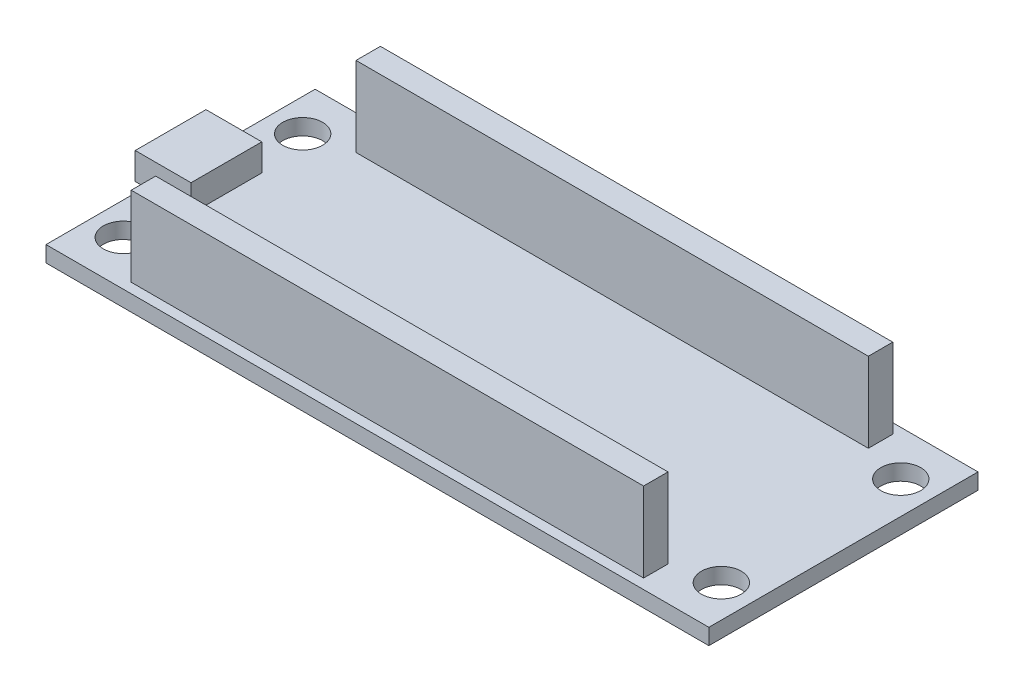
from build123d import *

# Parameters (mm, degrees)
SKETCH1_W           = 66.5
SKETCH1_H           = 27
SKETCH1_R           = 2
BOSS_EXTRUDE1_DEPTH = 1.6
SKETCH2_W           = 5.6
SKETCH2_H           = 7.1
BOSS_EXTRUDE2_DEPTH = 2.7
SKETCH3_W           = 51.4
SKETCH3_H           = 2.45
BOSS_EXTRUDE3_DEPTH = 8


with BuildPart() as part:
    # Sketch1 → Boss-Extrude1 (new body)
    with BuildSketch(Plane(origin=(0, 0, 0), x_dir=(1, 0, 0), z_dir=(0, 1, 0))):
        Rectangle(SKETCH1_W, SKETCH1_H)
        with Locations(Location((-30, 9, 0), (0, 0, 270))):
            Circle(SKETCH1_R, mode=Mode.SUBTRACT)
        with Locations(Location((-30, -9, 0), (0, 0, 270))):
            Circle(SKETCH1_R, mode=Mode.SUBTRACT)
        with Locations(Location((30, -9, 0), (0, 0, 270))):
            Circle(SKETCH1_R, mode=Mode.SUBTRACT)
        with Locations(Location((30, 9, 0), (0, 0, 270))):
            Circle(SKETCH1_R, mode=Mode.SUBTRACT)
    extrude(amount=BOSS_EXTRUDE1_DEPTH)

    # Sketch2 → Boss-Extrude2 (add)
    with BuildSketch(Plane(origin=(0, 1.6, 0), x_dir=(1, 0, 0), z_dir=(0, 1, 0))):
        with Locations((-31.45, 0)):
            Rectangle(SKETCH2_W, SKETCH2_H)
    extrude(amount=BOSS_EXTRUDE2_DEPTH)

    # Sketch3 → Boss-Extrude3 (add)
    with BuildSketch(Plane(origin=(0, 1.6, 0), x_dir=(1, 0, 0), z_dir=(0, 1, 0))):
        with Locations((0, 11.275)):
            Rectangle(SKETCH3_W, SKETCH3_H)
        with Locations((0, -11.275)):
            Rectangle(SKETCH3_W, SKETCH3_H)
    extrude(amount=BOSS_EXTRUDE3_DEPTH)


solid = part.part
